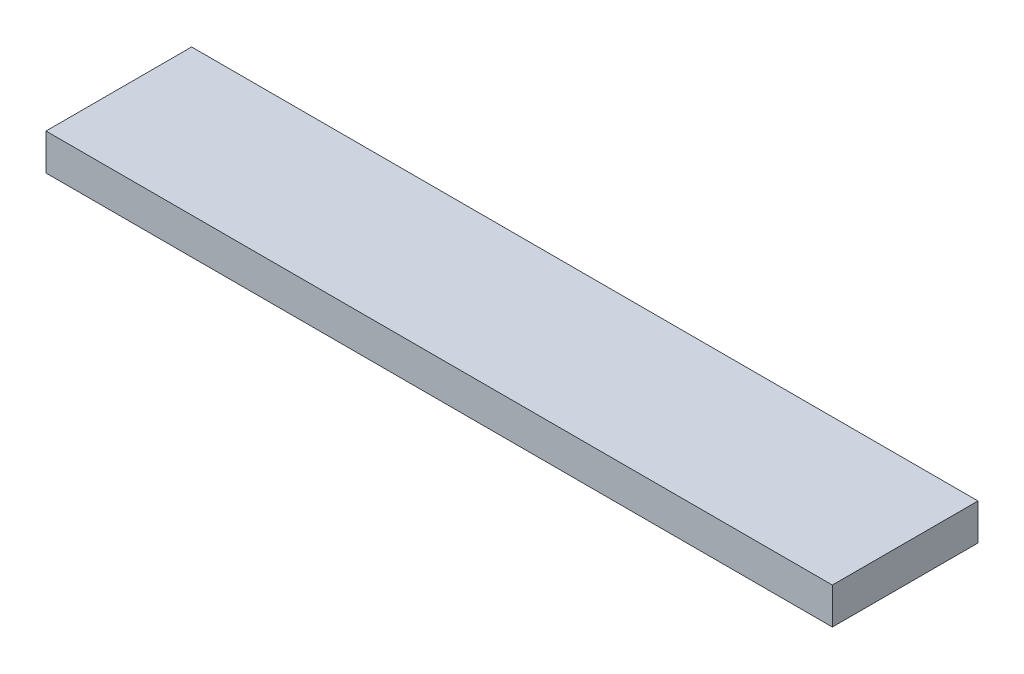
from build123d import *

# Parameters (mm, degrees)
SKETCH1_W           = 68.58
SKETCH1_H           = 12.7
BOSS_EXTRUDE1_DEPTH = 3.175


with BuildPart() as part:
    # Sketch1 → Boss-Extrude1 (new body)
    with BuildSketch(Plane(origin=(0, 0, 0), x_dir=(1, 0, 0), z_dir=(0, 1, 0))):
        with Locations((34.29, 6.35)):
            Rectangle(SKETCH1_W, SKETCH1_H)
    extrude(amount=BOSS_EXTRUDE1_DEPTH)


solid = part.part
